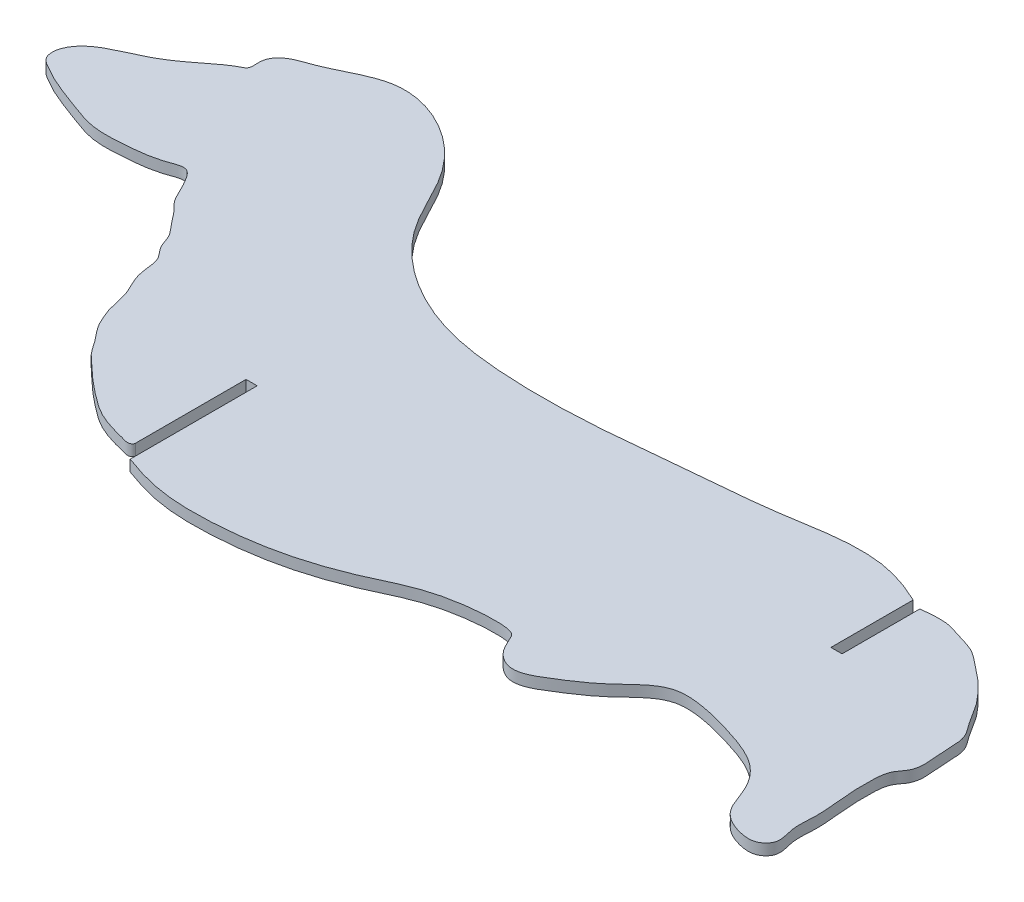
from build123d import *

# Parameters (mm, degrees)
EXTRUDE_1_DEPTH = 4


with BuildPart() as part:
    # Эскиз1 → Бобышка-Вытянуть1 (new body)
    with BuildSketch(Plane(origin=(0, 0, 0), x_dir=(1, 0, 0), z_dir=(0, 1, 0))):
        with BuildLine():
            Line((158.758898459, 127.645528434), (162.758898459, 127.645528434))
            Line((162.758898459, 127.645528434), (162.758898459, 82.027630033))
            add(Edge.make_bspline(
                [(162.758898459, 82.027630033), (174.080106129, 77.736391241), (187.326611617, 76.221095788), (208.57413234, 77.695130142), (225.784102355, 81.356915849), (244.050893382, 88.233388567), (258.84085098, 96.623366522), (284.417834843, 98.384503625), (287.140843266, 94.071437776), (288.87397116, 88.938395947), (296.8101038, 83.327539186), (308.059611208, 90.267030585), (319.355749973, 97.707887657), (329.284864382, 109.385565448), (343.698502795, 108.030738102), (356.212606759, 104.464890414), (369.078058081, 99.863346699), (376.510774585, 89.763124314), (378.865577034, 79.140410563), (387.54289752, 75.205252434), (394.304392522, 74.679804447), (398.997386218, 79.179694737), (396.082576083, 85.981021463), (397.401742886, 95.069389658), (395.872672975, 105.063288628), (395.642107926, 114.410455824), (396.112212051, 121.334374207), (399.267897263, 124.642599033), (400.514016983, 128.494387448), (400.174463102, 132.172542363), (399.834010289, 136.411832062), (399.714343935, 140.756709086), (399.278804107, 145.681210166), (395.103537132, 150.824508366), (392.118378535, 156.654643058), (387.058416159, 162.344018108), (382.721951942, 166.557677857), (377.764807482, 170.206950938), (373.121683236, 174.205233471), (363.956761152, 176.26357431), (360.888821507, 178.490697637), (351.154940736, 177.212936174)],
                knots=[0, 0, 0, 0, 0.035769596, 0.062719806, 0.088966252, 0.112042963, 0.143490392, 0.174363348, 0.179831805, 0.198174964, 0.221107831, 0.260435571, 0.304523347, 0.35589799, 0.389330046, 0.4314381, 0.480921036, 0.511393251, 0.545692039, 0.576182309, 0.593068315, 0.606430664, 0.628498821, 0.653091878, 0.693002416, 0.721356272, 0.742255958, 0.75437625, 0.762723164, 0.779364136, 0.788394639, 0.80258361, 0.82045255, 0.832717095, 0.863421332, 0.881695205, 0.903654668, 0.919957569, 0.939264846, 0.960992438, 1, 1, 1, 1], degree=3))
            Line((351.154940736, 177.212936174), (351.154940736, 149.302896472))
            Line((351.154940736, 149.302896472), (347.154940736, 149.302896472))
            Line((347.154940736, 149.302896472), (347.154940736, 178.835013288))
            add(Edge.make_bspline(
                [(347.154940736, 178.835013288), (342.293607839, 181.186392839), (331.732424641, 185.153225371), (314.956061353, 185.038996912), (301.512037992, 182.548513603), (288.369314791, 180.71253175), (275.639773262, 179.518770363), (261.906917647, 178.331665971), (236.902942328, 175.607244471), (210.119280858, 174.212997398), (171.594159561, 179.382417069), (143.243942178, 196.951507973), (132.124684399, 225.94674146), (116.595629552, 241.881053306), (93.27450234, 249.601998197), (77.888185456, 238.714659758), (65.900776433, 235.41017288), (61.575621974, 230.200420009), (63.108733654, 225.045424662), (58.256901059, 222.644574466), (51.96125016, 217.765196502), (40.102849662, 208.402991106), (25.000057747, 204.584232406), (21.984786793, 195.272937399), (22.343403809, 191.414002467), (26.572957553, 188.934116634), (32.41954656, 185.632752641), (41.394029652, 182.580420961), (52.254167402, 177.924905928), (64.955899896, 178.92481508), (74.517793939, 179.764064841), (82.751977437, 183.513799817), (85.949690163, 178.772495524), (88.185276848, 174.730099673), (90.090680672, 170.107982483), (94.233705881, 166.565028145), (96.970681713, 162.305172448), (100.834329657, 158.438030067), (101.758335514, 153.260977062), (106.234933483, 149.362890403), (106.22129292, 143.311246981), (107.917669572, 137.852932471), (111.115416691, 132.255595863), (111.717279818, 126.531053278), (113.762529452, 121.417745579), (115.787967736, 116.925498418), (119.69611368, 112.776543782), (122.55939647, 107.879756861), (126.811902979, 104.312348215), (131.204516655, 99.984187388), (137.851723765, 94.760355767), (144.639485049, 89.677093139), (154.332393865, 87.330227086), (154.676156101, 87.283350509), (158.493043826, 85.940283196), (158.799844599, 87.872057174), (158.758898459, 87.871134605)],
                knots=[0, 0, 0, 0, 0.027870908, 0.057050492, 0.08488055, 0.09828226, 0.125273317, 0.150633205, 0.169161561, 0.254719751, 0.287216714, 0.369493076, 0.408005119, 0.444216094, 0.481764451, 0.52197658, 0.534426007, 0.545221417, 0.553498076, 0.555204353, 0.571842806, 0.594976771, 0.634375329, 0.637983125, 0.644971727, 0.652095715, 0.66152778, 0.680136979, 0.70047289, 0.721552303, 0.743317142, 0.753145997, 0.760746768, 0.768608091, 0.778040157, 0.78561897, 0.796196846, 0.804076921, 0.813061588, 0.821979554, 0.832551784, 0.842282959, 0.851406114, 0.865319094, 0.871224097, 0.879723851, 0.890432724, 0.90025933, 0.908606328, 0.918705106, 0.932164238, 0.951132918, 0.966810127, 0.969283817, 0.975869816, 1, 1, 1, 1], degree=3))
            Line((158.758898459, 87.871134605), (158.758898459, 127.645528434))
        make_face()
    extrude(amount=EXTRUDE_1_DEPTH)


solid = part.part
